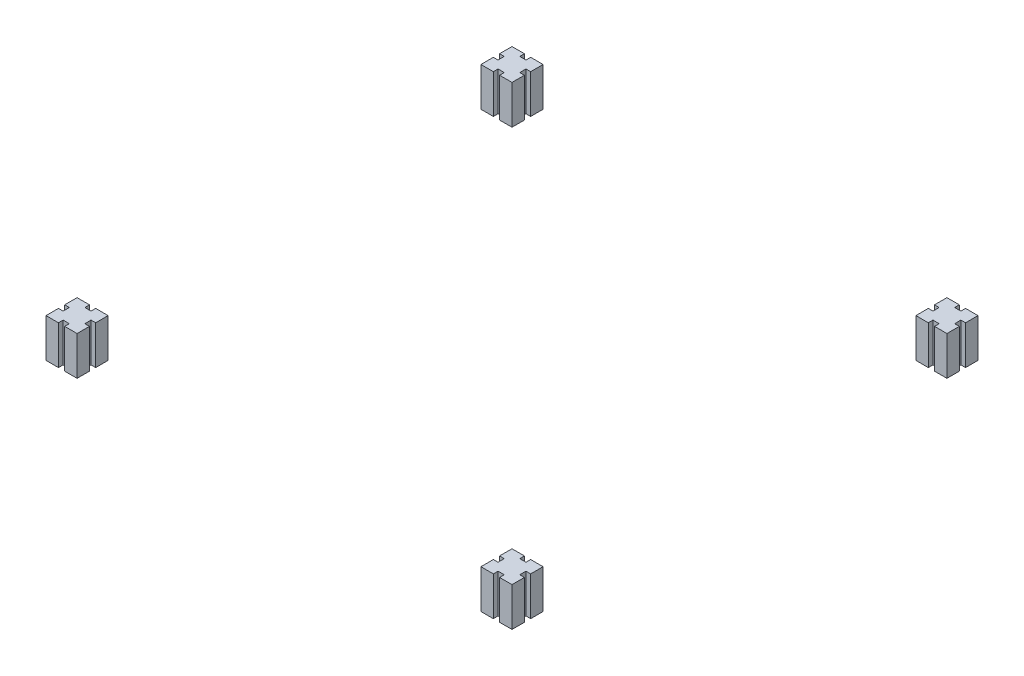
from build123d import *

# Parameters (mm, degrees)
BOSS_EXTRUDE1_DEPTH        = 25
BOSS_EXTRUDE1_DEPTH_BACK   = 25
SKETCH2_W                  = 40
SKETCH2_H                  = 40
BOSS_EXTRUDE1_2_DEPTH      = 25
BOSS_EXTRUDE1_2_DEPTH_BACK = 25
BOSS_EXTRUDE1_3_DEPTH      = 25
BOSS_EXTRUDE1_3_DEPTH_BACK = 25
BOSS_EXTRUDE1_4_DEPTH      = 25
BOSS_EXTRUDE1_4_DEPTH_BACK = 25
CUT_EXTRUDE1_DEPTH         = 426
CUT_EXTRUDE1_DEPTH_BACK    = 426
SKETCH3_W                  = 12
SKETCH3_H                  = 8
SKETCH3_W_2                = 8
SKETCH3_H_2                = 12


with BuildPart() as part:
    # Sketch2 → Boss-Extrude1 (new, two sides: drawn at the far end of the back side and taken through both)
    with BuildSketch(Plane(origin=(0, 0, 0), x_dir=(1, 0, 0), z_dir=(0, 1, 0)).offset(-BOSS_EXTRUDE1_DEPTH_BACK)):
        with Locations((-280, 280)):
            Rectangle(SKETCH2_W, SKETCH2_H)
    extrude(amount=BOSS_EXTRUDE1_DEPTH + BOSS_EXTRUDE1_DEPTH_BACK)


with BuildPart() as body_2:
    # Sketch2 → Boss-Extrude1 2 (new, two sides: drawn at the far end of the back side and taken through both)
    with BuildSketch(Plane(origin=(0, 0, 0), x_dir=(1, 0, 0), z_dir=(0, 1, 0)).offset(-BOSS_EXTRUDE1_2_DEPTH_BACK)):
        with Locations((280, 280)):
            Rectangle(SKETCH2_W, SKETCH2_H)
    extrude(amount=BOSS_EXTRUDE1_2_DEPTH + BOSS_EXTRUDE1_2_DEPTH_BACK)


with BuildPart() as body_3:
    # Sketch2 → Boss-Extrude1 3 (new, two sides: drawn at the far end of the back side and taken through both)
    with BuildSketch(Plane(origin=(0, 0, 0), x_dir=(1, 0, 0), z_dir=(0, 1, 0)).offset(-BOSS_EXTRUDE1_3_DEPTH_BACK)):
        with Locations((280, -280)):
            Rectangle(SKETCH2_W, SKETCH2_H)
    extrude(amount=BOSS_EXTRUDE1_3_DEPTH + BOSS_EXTRUDE1_3_DEPTH_BACK)


with BuildPart() as body_4:
    # Sketch2 → Boss-Extrude1 4 (new, two sides: drawn at the far end of the back side and taken through both)
    with BuildSketch(Plane(origin=(0, 0, 0), x_dir=(1, 0, 0), z_dir=(0, 1, 0)).offset(-BOSS_EXTRUDE1_4_DEPTH_BACK)):
        with Locations((-280, -280)):
            Rectangle(SKETCH2_W, SKETCH2_H)
    extrude(amount=BOSS_EXTRUDE1_4_DEPTH + BOSS_EXTRUDE1_4_DEPTH_BACK)


with BuildPart() as cut_extrude1_tool:
    # Sketch3 → Cut-Extrude1 (new, two sides: drawn at the far end of the back side and taken through both)
    with BuildSketch(Plane(origin=(0, 0, 0), x_dir=(1, 0, 0), z_dir=(0, 1, 0)).offset(-CUT_EXTRUDE1_DEPTH_BACK)):
        with Locations((-260, 280)):
            Rectangle(SKETCH3_W, SKETCH3_H)
        with Locations((-280, 300)):
            Rectangle(SKETCH3_W_2, SKETCH3_H_2)
        with Locations((-280, 260)):
            Rectangle(SKETCH3_W_2, SKETCH3_H_2)
        with Locations((-300, 280)):
            Rectangle(SKETCH3_W, SKETCH3_H)
        with Locations((300, 280)):
            Rectangle(SKETCH3_W, SKETCH3_H)
        with Locations((280, 260)):
            Rectangle(SKETCH3_W_2, SKETCH3_H_2)
        with Locations((260, 280)):
            Rectangle(SKETCH3_W, SKETCH3_H)
        with Locations((280, 300)):
            Rectangle(SKETCH3_W_2, SKETCH3_H_2)
        with Locations((260, -280)):
            Rectangle(SKETCH3_W, SKETCH3_H)
        with Locations((280, -300)):
            Rectangle(SKETCH3_W_2, SKETCH3_H_2)
        with Locations((280, -260)):
            Rectangle(SKETCH3_W_2, SKETCH3_H_2)
        with Locations((300, -280)):
            Rectangle(SKETCH3_W, SKETCH3_H)
        with Locations((-300, -280)):
            Rectangle(SKETCH3_W, SKETCH3_H)
        with Locations((-280, -260)):
            Rectangle(SKETCH3_W_2, SKETCH3_H_2)
        with Locations((-260, -280)):
            Rectangle(SKETCH3_W, SKETCH3_H)
        with Locations((-280, -300)):
            Rectangle(SKETCH3_W_2, SKETCH3_H_2)
    extrude(amount=CUT_EXTRUDE1_DEPTH + CUT_EXTRUDE1_DEPTH_BACK)


with BuildPart() as part_1:
    add(part.part)

    # Cut-Extrude1: cut by cut_extrude1_tool
    add(cut_extrude1_tool.part, mode=Mode.SUBTRACT)


with BuildPart() as body_2_1:
    add(body_2.part)

    # Cut-Extrude1: cut by cut_extrude1_tool
    add(cut_extrude1_tool.part, mode=Mode.SUBTRACT)


with BuildPart() as body_3_1:
    add(body_3.part)

    # Cut-Extrude1: cut by cut_extrude1_tool
    add(cut_extrude1_tool.part, mode=Mode.SUBTRACT)


with BuildPart() as body_4_1:
    add(body_4.part)

    # Cut-Extrude1: cut by cut_extrude1_tool
    add(cut_extrude1_tool.part, mode=Mode.SUBTRACT)


solid = Compound([part_1.part, body_2_1.part, body_3_1.part, body_4_1.part])
